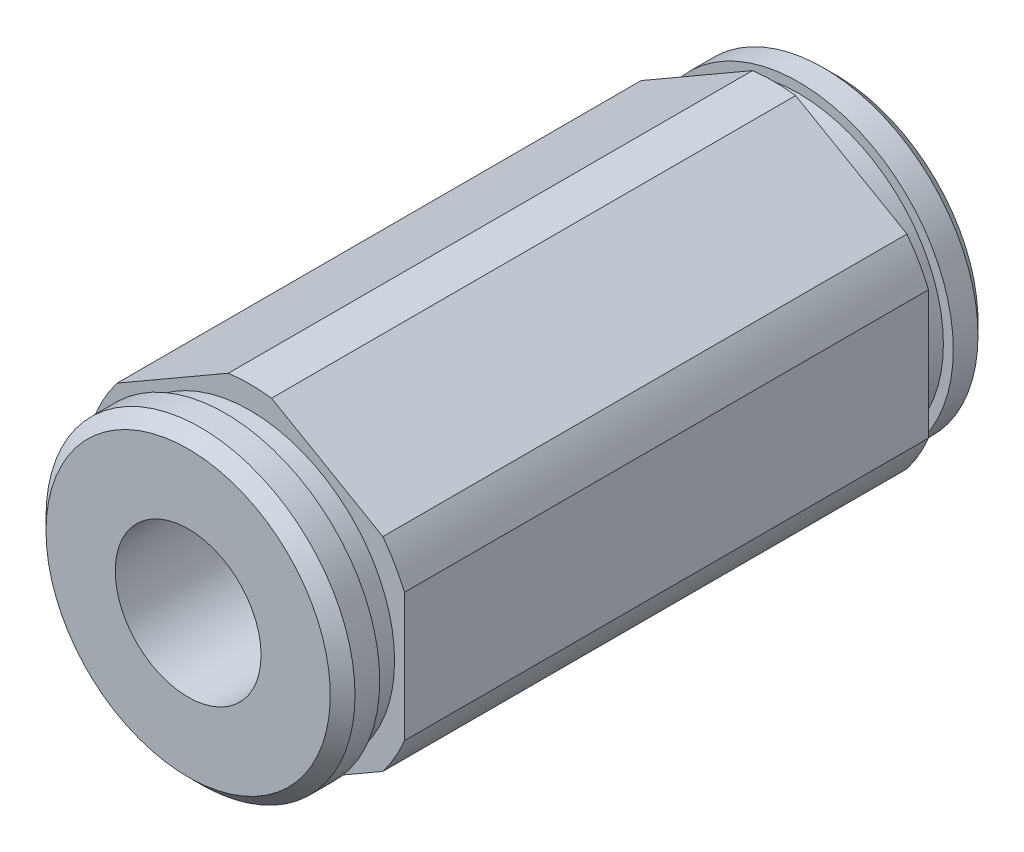
from build123d import *

# Parameters (mm, degrees)
BASIC_ROD_DEPTH         = 10.7696
BASIC_ROD_DEPTH_BACK    = 10.7696
SKETCH1_R               = 6.35
THEX_DEPTH              = 10.7696
INTERNAL_CUT_DEPTH      = 17.27150174
INTERNAL_CUT_DEPTH_BACK = 17.27150174
SKETCH2_R               = 2.9972


with BuildPart() as part:
    # Sketch1 → Basic Rod (new, two sides: drawn at the far end of the back side and taken through both)
    with BuildSketch(Plane.XY.offset(-BASIC_ROD_DEPTH_BACK)):
        with Locations(Location((0, 0, 0), (0, 0, 180))):
            Circle(SKETCH1_R)
    extrude(amount=BASIC_ROD_DEPTH + BASIC_ROD_DEPTH_BACK)

    # Sketch8 → THex (add, symmetric)
    with BuildSketch(Plane.XY):
        with BuildLine():
            Line((-0.888411378, 6.819423871), (-5.461588622, 4.179098758))
            ThreePointArc((-5.461588622, 4.179098758), (-5.955700003, 3.438525), (-6.35, 2.640325113))
            Line((-6.35, 2.640325113), (-6.35, -2.640325113))
            ThreePointArc((-6.35, -2.640325113), (-5.955700003, -3.438525), (-5.461588622, -4.179098758))
            Line((-5.461588622, -4.179098758), (-0.888411378, -6.819423871))
            ThreePointArc((-0.888411378, -6.819423871), (0, -6.87705), (0.888411378, -6.819423871))
            Line((0.888411378, -6.819423871), (5.461588622, -4.179098758))
            ThreePointArc((5.461588622, -4.179098758), (5.955700003, -3.438525), (6.35, -2.640325113))
            Line((6.35, -2.640325113), (6.35, 2.640325113))
            ThreePointArc((6.35, 2.640325113), (5.955700003, 3.438525), (5.461588622, 4.179098758))
            Line((5.461588622, 4.179098758), (0.888411378, 6.819423871))
            ThreePointArc((0.888411378, 6.819423871), (0, 6.87705), (-0.888411378, 6.819423871))
        make_face()
    extrude(amount=THEX_DEPTH, both=True)

    # Sketch7 → 1stSnapRing (revolve)
    with BuildSketch(Plane(origin=(0, 0, 0), x_dir=(0, 0, -1), z_dir=(1, 0, 0)), mode=Mode.PRIVATE) as f_1stsnapring_sk:
        Polygon((-10.7696, 5.9436), (-11.7856, 5.9436), (-11.7856, 6.35), (-12.8016, 6.35), (-13.3096, 5.842), (-13.3096, 0), (-10.7696, 0), align=None)
    f_1stsnapring = revolve(f_1stsnapring_sk.sketch.rotate(Axis((0, 0, -38.2778), (0, 0, 1)), 90), axis=Axis((0, 0, -38.2778), (0, 0, 1)))

    # 2ndSnapRing: 1stSnapRing across plane
    add(f_1stsnapring.mirror(Plane.XY))

    # Sketch2 → Internal Cut (cut, two sides: drawn at the far end of the back side and taken through both)
    with BuildSketch(Plane.XY.offset(-INTERNAL_CUT_DEPTH_BACK)):
        Circle(SKETCH2_R)
    extrude(amount=INTERNAL_CUT_DEPTH + INTERNAL_CUT_DEPTH_BACK, mode=Mode.SUBTRACT)


solid = part.part
